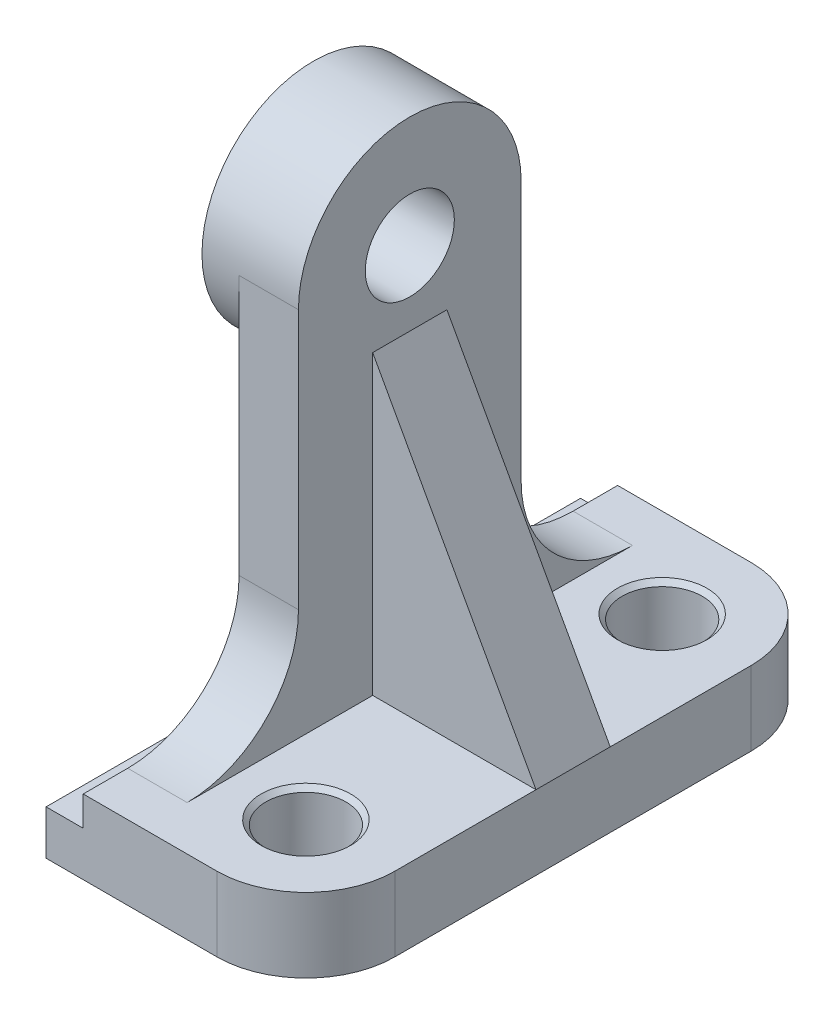
from build123d import *

# Parameters (mm, degrees)
BOSS_EXTRUDE1_DEPTH               = 36
BOSS_EXTRUDE2_DEPTH               = 8
FILLET1_R                         = 15
BOSS_EXTRUDE3_START               = 5
SKETCH3_R                         = 15
BOSS_EXTRUDE3_DEPTH               = 5
HOLE1_D                           = 12
HOLE1_DEPTH                       = 27.75
FILLET2_R                         = 12
M12X1_25_TAPPED_HOLE1_D           = 10.8
M12X1_25_TAPPED_HOLE1_DEPTH       = 24.505352657
M12X1_25_TAPPED_HOLE1_CSINK_D     = 12.05
M12X1_25_TAPPED_HOLE1_CSINK_ANGLE = 90
M12X1_25_TAPPED_HOLE1_TIP         = 3.244647343
RIB1_REACH                        = 92.255
SKETCH8_WALL_W                    = 228.161236354
SKETCH8_WALL_H                    = 10


with BuildPart() as part:
    # Sketch1 → Boss-Extrude1 (new, symmetric)
    with BuildSketch(Plane.XY):
        Polygon((0, 0), (0, 6), (5, 6), (5, 10), (35, 10), (35, 0), align=None)
    extrude(amount=BOSS_EXTRUDE1_DEPTH, both=True)

    # Sketch2 → Boss-Extrude2 (add)
    with BuildSketch(Plane.ZY.offset(-5)):
        with BuildLine():
            Line((-15, 60), (-15, 10))
            Line((-15, 10), (15, 10))
            Line((15, 10), (15, 60))
            ThreePointArc((15, 60), (0, 75), (-15, 60))
        make_face()
    extrude(amount=-BOSS_EXTRUDE2_DEPTH)

    # Fillet1
    fillet1_edges = [part.edges().sort_by_distance(p)[0] for p in [
        (9, 10, 15),
        (9, 10, -15),
    ]]
    fillet(fillet1_edges, radius=FILLET1_R)

    # Sketch3 → Boss-Extrude3 (add)
    with BuildSketch(Plane.ZY.offset(-5).offset(BOSS_EXTRUDE3_START)):
        with Locations((0, 60)):
            Circle(SKETCH3_R)
    extrude(amount=-BOSS_EXTRUDE3_DEPTH)

    # Hole1
    with Locations(Plane(origin=(13, 0, 0), x_dir=(0, 0, -1), z_dir=(1, 0, 0))):
        with Locations((0, 60)):
            Hole(HOLE1_D / 2, depth=HOLE1_DEPTH)

    # Fillet2
    fillet2_edges = [part.edges().sort_by_distance(p)[0] for p in [
        (35, 5, -36),
        (35, 5, 36),
    ]]
    fillet(fillet2_edges, radius=FILLET2_R)

    # M12x1.25 Tapped Hole1
    with Locations(Plane(origin=(0, 10, 0), x_dir=(1, 0, 0), z_dir=(0, 1, 0))):
        with Locations((23, -24), (23, 24)):
            CounterSinkHole(M12X1_25_TAPPED_HOLE1_D / 2, M12X1_25_TAPPED_HOLE1_CSINK_D / 2, depth=M12X1_25_TAPPED_HOLE1_DEPTH, counter_sink_angle=M12X1_25_TAPPED_HOLE1_CSINK_ANGLE)
            with Locations((0, 0, -(M12X1_25_TAPPED_HOLE1_DEPTH + M12X1_25_TAPPED_HOLE1_TIP / 2))):  # 118° drill point
                Cone(0, M12X1_25_TAPPED_HOLE1_D / 2, M12X1_25_TAPPED_HOLE1_TIP, mode=Mode.SUBTRACT)

    # Sketch8 wall → Rib1 (add, up to next)
    with BuildSketch(Plane(origin=(24, 30, 0), x_dir=(-0.481918749772, 0.876215908677, 0), z_dir=(-0.876215908677, -0.481918749772, 0)), mode=Mode.PRIVATE) as rib1_sk1:
        Rectangle(SKETCH8_WALL_W, SKETCH8_WALL_H)
    rib1_tool1 = extrude(rib1_sk1.sketch, amount=RIB1_REACH, mode=Mode.PRIVATE) - part.part
    add(rib1_tool1.solids().sort_by_distance((24, 30, 0))[0])


solid = part.part
